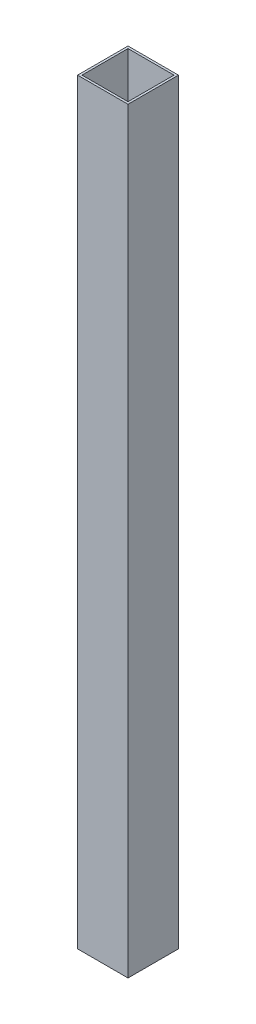
from build123d import *

# Parameters (mm, degrees)
SKETCH1_W           = 50
SKETCH1_H           = 50
SKETCH1_W_2         = 45.6
SKETCH1_H_2         = 45.6
BOSS_EXTRUDE1_DEPTH = 750


with BuildPart() as part:
    # Sketch1 → Boss-Extrude1 (new body)
    with BuildSketch(Plane(origin=(0, 0, 0), x_dir=(1, 0, 0), z_dir=(0, 1, 0))):
        with Locations((25, 25)):
            Rectangle(SKETCH1_W, SKETCH1_H)
        with Locations((25, 25)):
            Rectangle(SKETCH1_W_2, SKETCH1_H_2, mode=Mode.SUBTRACT)
    extrude(amount=BOSS_EXTRUDE1_DEPTH)


solid = part.part
